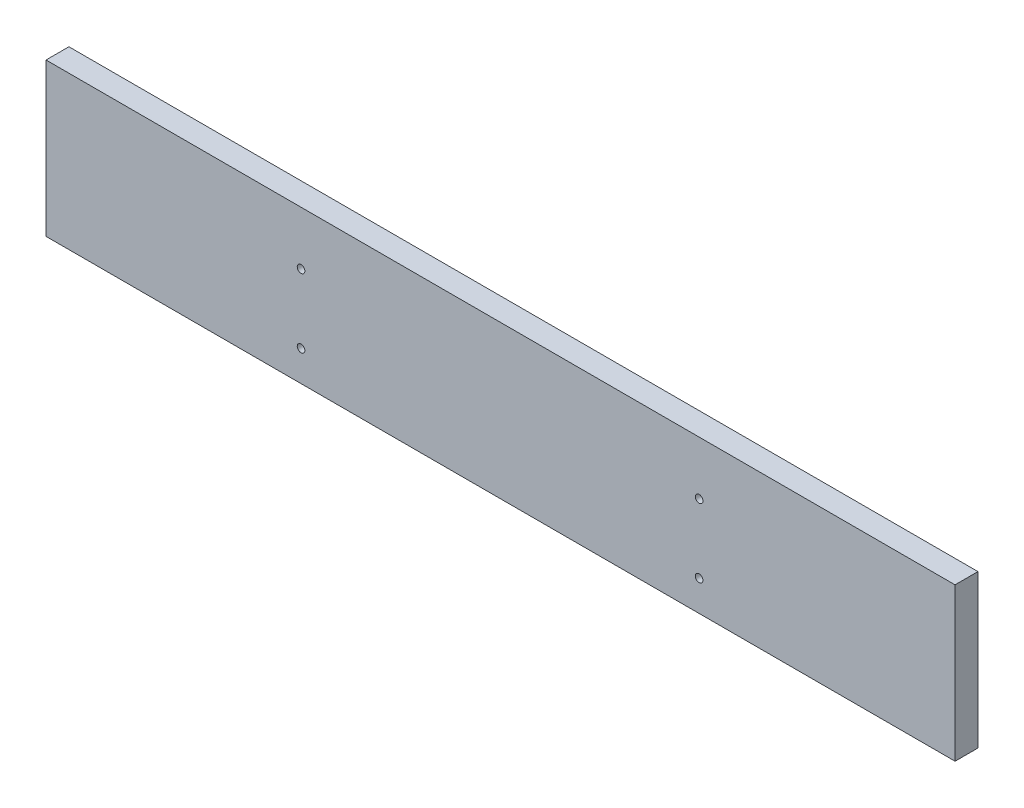
from build123d import *

# Parameters (mm, degrees)
BOSS_EXTRUDE1_DEPTH         = 19.05
F_1_4_0_25_DIAMETER_HOLE1_D = 6.35


with BuildPart() as part:
    # Sketch1 → Boss-Extrude1 (new body)
    with BuildSketch(Plane.XY.offset(-348.182458287)):
        Polygon((391.497753528, 164.483362877), (-364.152246472, 164.483362877), (-364.152246472, 37.483362877), (391.538596905, 37.483362877), align=None)
    extrude(amount=BOSS_EXTRUDE1_DEPTH)

    # 1/4 (0.25) Diameter Hole1 (through all)
    with Locations(Plane.XY.offset(-329.132458287)):
        with Locations((-152.13904646, 120.033362877), (-152.13904646, 62.883362877), (178.772753528, 62.883362877), (178.772753528, 120.033362877)):
            Hole(F_1_4_0_25_DIAMETER_HOLE1_D / 2)


solid = part.part
